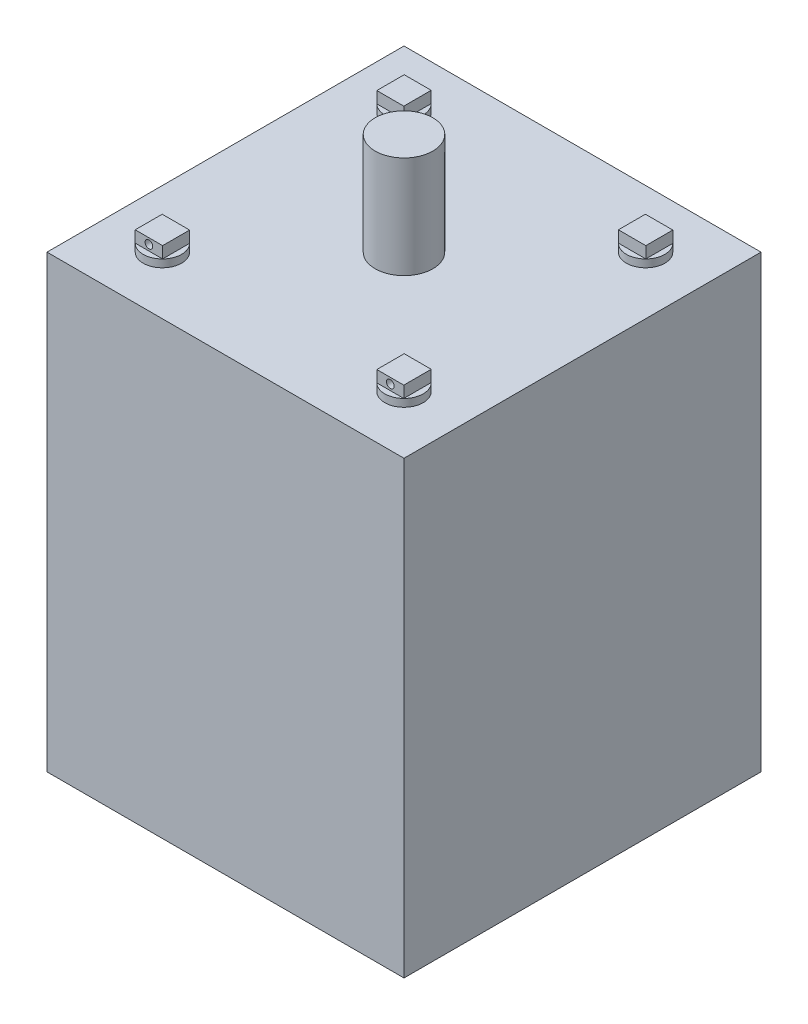
from build123d import *

# Parameters (mm, degrees)
SKETCH1_W                                  = 92.8
SKETCH1_H                                  = 92.8
BOSS_EXTRUDE1_DEPTH                        = 117
BOSS_EXTRUDE2_START                        = -117
SKETCH2_R                                  = 7.5
BOSS_EXTRUDE2_DEPTH                        = 143.5
BOSS_EXTRUDE3_DEPTH                        = 2
SKETCH4_W                                  = 7.017872994
SKETCH4_H                                  = 7.12386543
BOSS_EXTRUDE4_DEPTH                        = 3
SKETCH5_R                                  = 1
CUT_EXTRUDE1_DEPTH                         = 3.5
CIRPATTERN1_COUNT                          = 4
MIRROR2_AT_THE_SECOND_PLANE_COPY_1_SKETC_R = 1
MIRROR2_AT_THE_SECOND_PLANE_COPY_1_DEPTH   = 3.5


with BuildPart() as part:
    # Sketch1 → Boss-Extrude1 (new body)
    with BuildSketch(Plane(origin=(0, 0, 0), x_dir=(1, 0, 0), z_dir=(0, 1, 0))):
        with Locations((46.4, 46.4)):
            Rectangle(SKETCH1_W, SKETCH1_H)
    extrude(amount=BOSS_EXTRUDE1_DEPTH)

    # Sketch2 → Boss-Extrude2 (add)
    with BuildSketch(Plane(origin=(0, 117, 0), x_dir=(1, 0, 0), z_dir=(0, 1, 0)).offset(BOSS_EXTRUDE2_START)):
        with Locations(Location((46.4, 46.4, 0), (0, 0, 90))):
            Circle(SKETCH2_R)
    extrude(amount=BOSS_EXTRUDE2_DEPTH)

    # Sketch3 → Boss-Extrude3 (add)
    with BuildSketch(Plane(origin=(0, 117, 0), x_dir=(1, 0, 0), z_dir=(0, 1, 0))):
        with BuildLine():
            ThreePointArc((15, 72.8), (18.535533906, 74.264466094), (20, 77.8))
            Line((20, 77.8), (15, 77.8))
            Line((15, 77.8), (15, 72.8))
        make_face()
        with BuildLine():
            Line((15, 77.8), (20, 77.8))
            ThreePointArc((20, 77.8), (11.464466094, 81.335533906), (15, 72.8))
            Line((15, 72.8), (15, 77.8))
        make_face()
        with BuildLine():
            ThreePointArc((15, 72.8), (18.535533906, 74.264466094), (20, 77.8))
            Line((20, 77.8), (15, 77.8))
            Line((15, 77.8), (15, 72.8))
        make_face()
        with BuildLine():
            Line((15, 77.8), (20, 77.8))
            ThreePointArc((20, 77.8), (11.464466094, 81.335533906), (15, 72.8))
            Line((15, 72.8), (15, 77.8))
        make_face()
    boss_extrude3 = extrude(amount=BOSS_EXTRUDE3_DEPTH)

    # Sketch4 → Boss-Extrude4 (add)
    with BuildSketch(Plane(origin=(0, 119, 0), x_dir=(1, 0, 0), z_dir=(0, 1, 0))):
        with Locations((15, 77.8)):
            Rectangle(SKETCH4_W, SKETCH4_H)
    boss_extrude4 = extrude(amount=BOSS_EXTRUDE4_DEPTH)

    # Sketch5 → Cut-Extrude1 (cut)
    with BuildSketch(Plane(origin=(0, 0, -81.361932715), x_dir=(-1, 0, 0), z_dir=(0, 0, -1))):
        with Locations((-15, 120.5)):
            Circle(SKETCH5_R)
    cut_extrude1 = extrude(amount=-CUT_EXTRUDE1_DEPTH, mode=Mode.SUBTRACT)

    # CirPattern1: Boss-Extrude3, Boss-Extrude4 ×4 about axis
    cirpattern1_axis = Axis((46.4, 0, -46.4), (0, 1, 0))
    add([boss_extrude3.rotate(cirpattern1_axis, i * 360 / CIRPATTERN1_COUNT) for i in range(1, CIRPATTERN1_COUNT)])
    add([boss_extrude4.rotate(cirpattern1_axis, i * 360 / CIRPATTERN1_COUNT) for i in range(1, CIRPATTERN1_COUNT)])

    # Mirror1: Cut-Extrude1 across plane
    add(cut_extrude1.mirror(Plane(origin=(0, 0, -46.4), x_dir=(1, 0, 0), z_dir=(0, 0, -1))), mode=Mode.SUBTRACT)

    # Mirror2: Cut-Extrude1 across plane
    add(cut_extrude1.mirror(Plane(origin=(46.4, 0, 0), x_dir=(0, 0, 1), z_dir=(1, 0, 0))), mode=Mode.SUBTRACT)

    # Mirror2 at the second plane: Cut-Extrude1 across plane
    add(cut_extrude1.mirror(Plane(origin=(0, 0, -46.4), x_dir=(1, 0, 0), z_dir=(0, 0, -1))), mode=Mode.SUBTRACT)

    # Mirror2 at the second plane copy 1 sketc → Mirror2 at the second plane copy 1 (cut)
    with BuildSketch(Plane(origin=(92.8, 0, -11.438067285), x_dir=(1, 0, 0), z_dir=(0, 0, 1))):
        with Locations((-15, 120.5)):
            Circle(MIRROR2_AT_THE_SECOND_PLANE_COPY_1_SKETC_R)
    extrude(amount=-MIRROR2_AT_THE_SECOND_PLANE_COPY_1_DEPTH, mode=Mode.SUBTRACT)


solid = part.part
